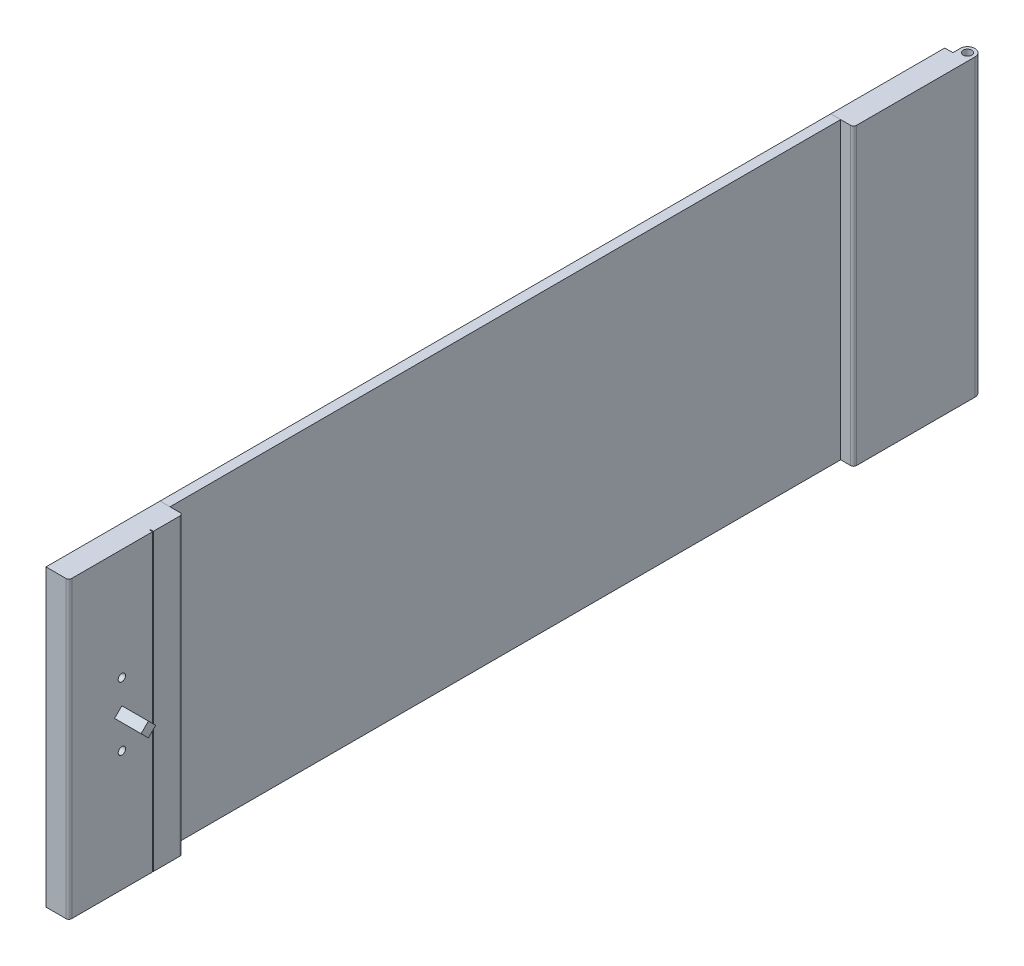
from build123d import *

# Parameters (mm, degrees)
SKETCH_1_R          = 2.931940553
EXTRUDE_1_DEPTH     = 200
EXTRUDE_1_2_DEPTH   = 200
SKETCH_2_W          = 6.75
SKETCH_2_H          = 455.2
EXTRUDE_2_DEPTH     = 200
EXTRUDE_3_DEPTH     = 18
SKETCH_3_3_R        = 2.5
CUT_EXTRUDE_1_DEPTH = 5


with BuildPart() as part:
    # Эскиз1 → Бобышка-Вытянуть1 (new body)
    with BuildSketch(Plane(origin=(0, 0, 0), x_dir=(1, 0, 0), z_dir=(0, 1, 0))):
        with BuildLine():
            Line((134.032480032, 108.848097027), (147.532480032, 108.848097027))
            ThreePointArc((147.532480032, 108.848097027), (148.946693595, 109.433883464), (149.532480032, 110.848097027))
            Line((149.532480032, 110.848097027), (149.532480032, 184.248097027))
            Line((149.532480032, 184.248097027), (149.532480032, 191.248097027))
            ThreePointArc((149.532480032, 191.248097027), (144.532480032, 196.248097027), (139.532480032, 191.248097027))
            Line((139.532480032, 191.248097027), (139.532480032, 186.248097027))
            Line((139.532480032, 186.248097027), (134.032480032, 186.248097027))
            Line((134.032480032, 186.248097027), (134.032480032, 108.848097027))
        make_face()
        with Locations((144.532480032, 191.248097027)):
            Circle(SKETCH_1_R, mode=Mode.SUBTRACT)
    extrude(amount=EXTRUDE_1_DEPTH)


with BuildPart() as body_2:
    # Эскиз1 → Extrude 1 2 (new body)
    with BuildSketch(Plane(origin=(0, 0, 0), x_dir=(1, 0, 0), z_dir=(0, 1, 0))):
        with BuildLine():
            Line((134.032480032, -423.751902973), (147.532480032, -423.751902973))
            ThreePointArc((147.532480032, -423.751902973), (148.946693595, -423.166116536), (149.532480032, -421.751902973))
            Line((149.532480032, -421.751902973), (149.532480032, -366.951902973))
            Line((149.532480032, -366.951902973), (147.532480032, -366.951902973))
            Line((147.532480032, -366.951902973), (147.532480032, -366.451902973))
            Line((147.532480032, -366.451902973), (149.532480032, -366.451902973))
            Line((149.532480032, -366.451902973), (149.532480032, -348.351902973))
            ThreePointArc((149.532480032, -348.351902973), (148.946693595, -346.937689411), (147.532480032, -346.351902973))
            Line((147.532480032, -346.351902973), (134.032480032, -346.351902973))
            Line((134.032480032, -346.351902973), (134.032480032, -423.751902973))
        make_face()
    extrude(amount=EXTRUDE_1_2_DEPTH)

    # Эскиз3 → Бобышка-Вытянуть3 (add)
    with BuildSketch(Plane(origin=(149.532480032, 0, 0), x_dir=(0, 0, -1), z_dir=(1, 0, 0))):
        Polygon((-387.751902973, 108.122367155), (-392.701650442, 103.172619686), (-387.751902973, 98.222872218), (-382.802155505, 103.172619686), align=None)
    extrude(amount=EXTRUDE_3_DEPTH)

    # Эскиз3<3> → Вырез-Вытянуть1 (cut)
    with BuildSketch(Plane(origin=(149.532480032, 0, 0), x_dir=(0, 0, -1), z_dir=(1, 0, 0))):
        with Locations((-387.751902973, 124.672619686)):
            Circle(SKETCH_3_3_R)
        with Locations((-387.751902973, 81.672619686)):
            Circle(SKETCH_3_3_R)
    extrude(amount=-CUT_EXTRUDE_1_DEPTH, mode=Mode.SUBTRACT)


with BuildPart() as body_3:
    # Эскиз2 → Бобышка-Вытянуть2 (new body)
    with BuildSketch(Plane(origin=(0, 200, 0), x_dir=(1, 0, 0), z_dir=(0, 1, 0))):
        with Locations((137.407480032, -118.751902973)):
            Rectangle(SKETCH_2_W, SKETCH_2_H)
    extrude(amount=-EXTRUDE_2_DEPTH)


solid = Compound([part.part, body_2.part, body_3.part])
